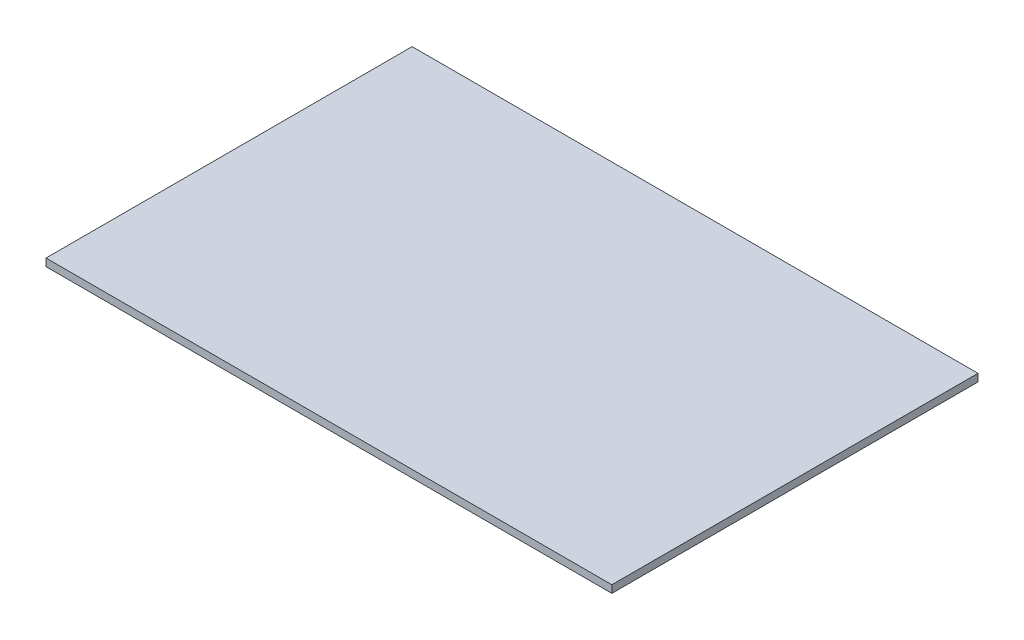
from build123d import *

# Parameters (mm, degrees)
SKETCH1_W           = 170
SKETCH1_H           = 110
BOSS_EXTRUDE1_DEPTH = 2.25


with BuildPart() as part:
    # Sketch1 → Boss-Extrude1 (new body)
    with BuildSketch(Plane(origin=(0, 0, 0), x_dir=(1, 0, 0), z_dir=(0, 1, 0))):
        Rectangle(SKETCH1_W, SKETCH1_H)
    extrude(amount=BOSS_EXTRUDE1_DEPTH)


solid = part.part
